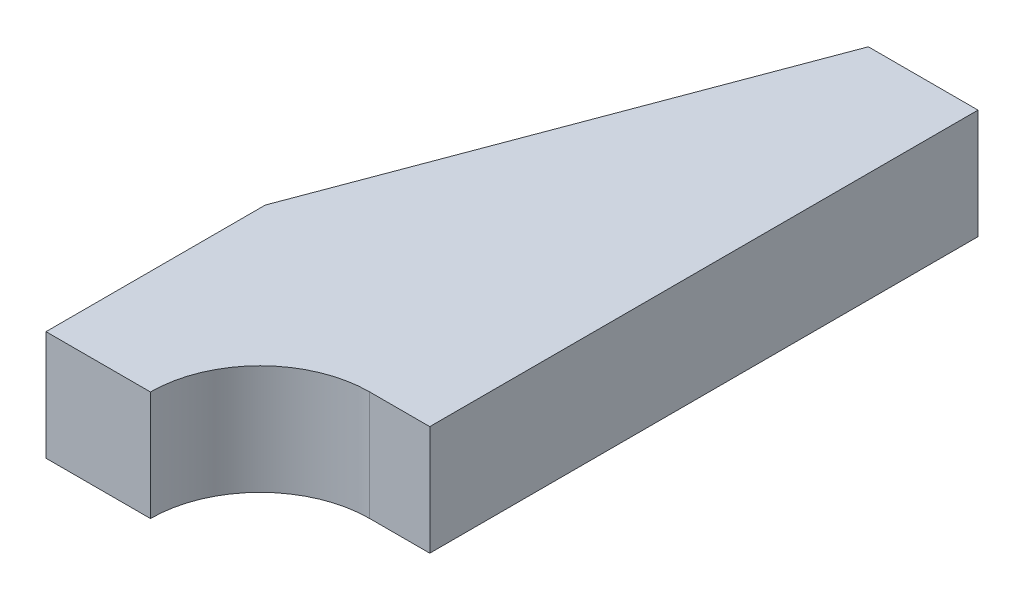
from build123d import *

# Parameters (mm, degrees)
SALIENTE_EXTRUIR1_DEPTH = 10


with BuildPart() as part:
    # Croquis1 → Saliente-Extruir1 (new body)
    with BuildSketch(Plane(origin=(0, 0, 0), x_dir=(1, 0, 0), z_dir=(0, 1, 0))):
        with BuildLine():
            Line((-12.5, 0), (-12.5, -20))
            Line((-12.5, -20), (-2.975, -20))
            ThreePointArc((-2.975, -20), (-0.046067812, -12.928932188), (7.025, -10))
            Line((7.025, -10), (12.5, -10))
            Line((12.5, -10), (12.5, 40))
            Line((12.5, 40), (2.5, 40))
            Line((2.5, 40), (-12.5, 0))
        make_face()
    extrude(amount=SALIENTE_EXTRUIR1_DEPTH)


solid = part.part
